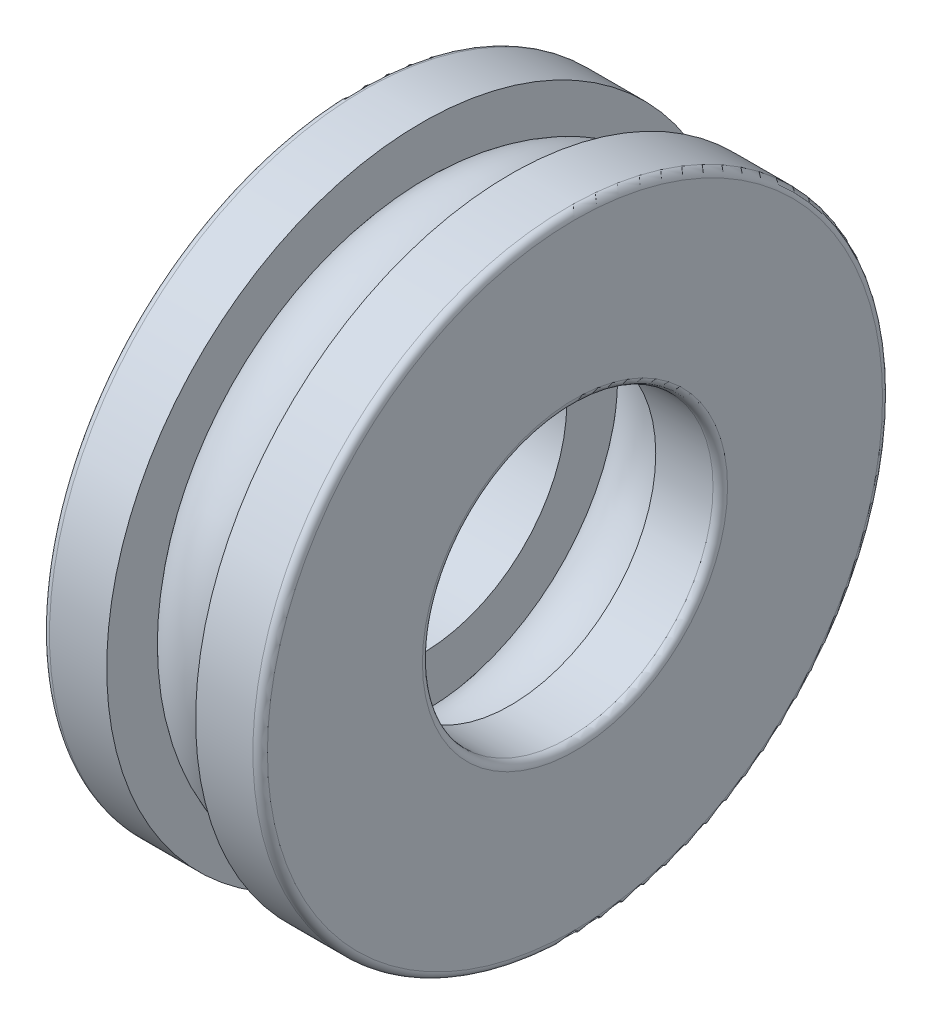
from build123d import *

# Parameters (mm, degrees)
BALSIMSKE_R = 2.295


with BuildPart() as part:
    # InnRacSke → Race (revolve)
    with BuildSketch(Plane.XY, mode=Mode.PRIVATE) as race_sk:
        with BuildLine():
            Line((-1.836, 8.165082774), (-1.836, 6))
            Line((-1.836, 6), (-4.2, 6))
            ThreePointArc((-4.2, 6), (-4.412132034, 6.087867966), (-4.5, 6.3))
            Line((-4.5, 6.3), (-4.5, 12.7))
            ThreePointArc((-4.5, 12.7), (-4.412132034, 12.912132034), (-4.2, 13))
            Line((-4.2, 13), (-1.836, 13))
            Line((-1.836, 13), (-1.836, 10.834917226))
            ThreePointArc((-1.836, 10.834917226), (-2.27, 9.5), (-1.836, 8.165082774))
        make_face()
    race = revolve(race_sk.sketch.rotate(Axis((-34.925, 0, 0), (1, 0, 0)), 270), axis=Axis((-34.925, 0, 0), (1, 0, 0)))

    # BalSimSke → BallsSimplified (revolve)
    with BuildSketch(Plane.XY, mode=Mode.PRIVATE) as ballssimplified_sk:
        with Locations((0, 9.5)):
            Circle(BALSIMSKE_R)
    revolve(ballssimplified_sk.sketch.rotate(Axis((-25.4, 0, 0), (1, 0, 0)), 90), axis=Axis((-25.4, 0, 0), (1, 0, 0)))

    # Mirror1: Race across plane
    add(race.mirror(Plane(origin=(0, 0, 0), x_dir=(0, 0, 1), z_dir=(1, 0, 0))))


solid = part.part
